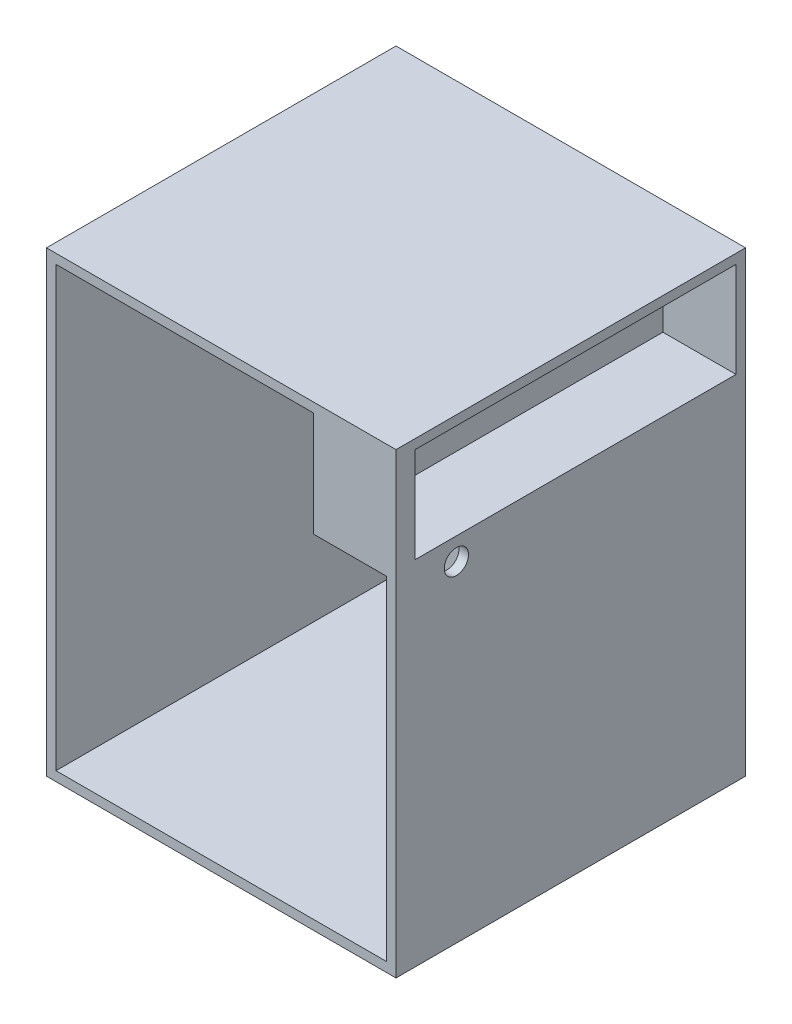
from build123d import *

# Parameters (mm, degrees)
CROQUIS1_W              = 550
CROQUIS1_H              = 550
SALIENTE_EXTRUIR1_DEPTH = 720
VACIADO1_T              = -15
SALIENTE_EXTRUIR2_DEPTH = 535
CROQUIS3_W              = 505
CROQUIS3_H              = 150
CORTAR_EXTRUIR1_DEPTH   = 115
CROQUIS4_W              = 15
CROQUIS4_H              = 150
SALIENTE_EXTRUIR3_DEPTH = 100
CROQUIS5_R              = 19.05
CORTAR_EXTRUIR2_DEPTH   = 30
CROQUIS6_R              = 19.05
CORTAR_EXTRUIR3_DEPTH   = 30


with BuildPart() as part:
    # Croquis1 → Saliente-Extruir1 (new body)
    with BuildSketch(Plane(origin=(0, 0, 0), x_dir=(1, 0, 0), z_dir=(0, 1, 0))):
        Rectangle(CROQUIS1_W, CROQUIS1_H)
    extrude(amount=SALIENTE_EXTRUIR1_DEPTH)

    # Vaciado1
    vaciado1_openings = [part.faces().sort_by_distance(p)[0] for p in [
        (0, 360, 275),
    ]]
    offset(amount=VACIADO1_T, openings=vaciado1_openings, kind=Kind.INTERSECTION)

    # Croquis2 → Saliente-Extruir2 (add)
    with BuildSketch(Plane.XY.offset(275)):
        Polygon((160, 705), (160, 555), (260, 555), (260, 540), (145, 540), (145, 705), align=None)
    extrude(amount=-SALIENTE_EXTRUIR2_DEPTH)

    # Croquis3 → Cortar-Extruir1 (cut)
    with BuildSketch(Plane(origin=(275, 0, 0), x_dir=(0, 0, -1), z_dir=(1, 0, 0))):
        with Locations((7.5, 630)):
            Rectangle(CROQUIS3_W, CROQUIS3_H)
    extrude(amount=-CORTAR_EXTRUIR1_DEPTH, mode=Mode.SUBTRACT)

    # Croquis4 → Saliente-Extruir3 (add)
    with BuildSketch(Plane(origin=(160, 0, 0), x_dir=(0, 0, -1), z_dir=(1, 0, 0))):
        with Locations((-267.5, 630)):
            Rectangle(CROQUIS4_W, CROQUIS4_H)
    extrude(amount=SALIENTE_EXTRUIR3_DEPTH)

    # Croquis5 → Cortar-Extruir2 (cut)
    with BuildSketch(Plane.ZY.offset(275)):
        with Locations((-180, 520)):
            Circle(CROQUIS5_R)
    extrude(amount=-CORTAR_EXTRUIR2_DEPTH, mode=Mode.SUBTRACT)

    # Croquis6 → Cortar-Extruir3 (cut)
    with BuildSketch(Plane(origin=(275, 0, 0), x_dir=(0, 0, -1), z_dir=(1, 0, 0))):
        with Locations((-180, 520)):
            Circle(CROQUIS6_R)
    extrude(amount=-CORTAR_EXTRUIR3_DEPTH, mode=Mode.SUBTRACT)


solid = part.part
